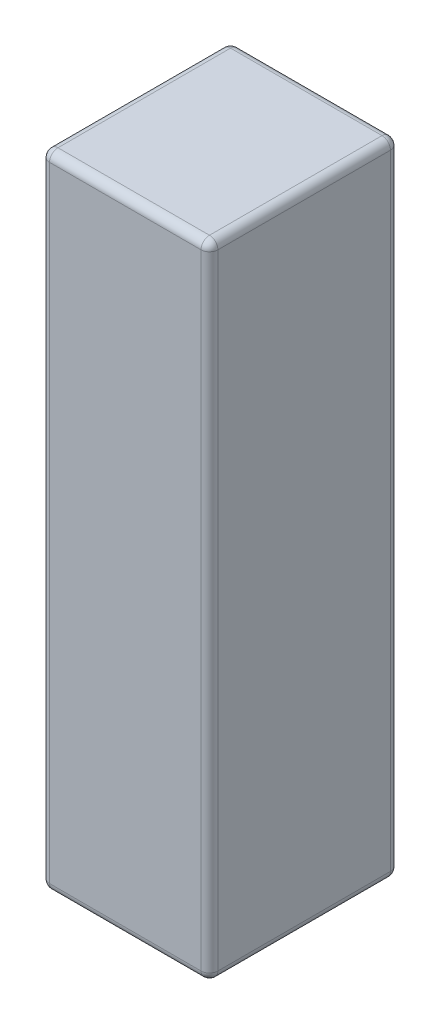
from build123d import *

# Parameters (mm, degrees)
SKETCH1_W           = 40
SKETCH1_H           = 45
BOSS_EXTRUDE1_DEPTH = 152.4
FILLET1_R           = 2


with BuildPart() as part:
    # Sketch1 → Boss-Extrude1 (new body)
    with BuildSketch(Plane(origin=(0, 0, 0), x_dir=(1, 0, 0), z_dir=(0, 1, 0))):
        Rectangle(SKETCH1_W, SKETCH1_H)
    extrude(amount=BOSS_EXTRUDE1_DEPTH)

    # Fillet1
    fillet1_edges = [part.edges().sort_by_distance(p)[0] for p in [
        (20, 152.4, 0),
        (0, 152.4, -22.5),
        (-20, 152.4, 0),
        (0, 0, -22.5),
        (20, 0, 0),
        (0, 0, 22.5),
        (-20, 0, 0),
        (-20, 76.2, -22.5),
        (20, 76.2, -22.5),
        (20, 76.2, 22.5),
        (-20, 76.2, 22.5),
        (0, 152.4, 22.5),
    ]]
    fillet(fillet1_edges, radius=FILLET1_R)


solid = part.part
